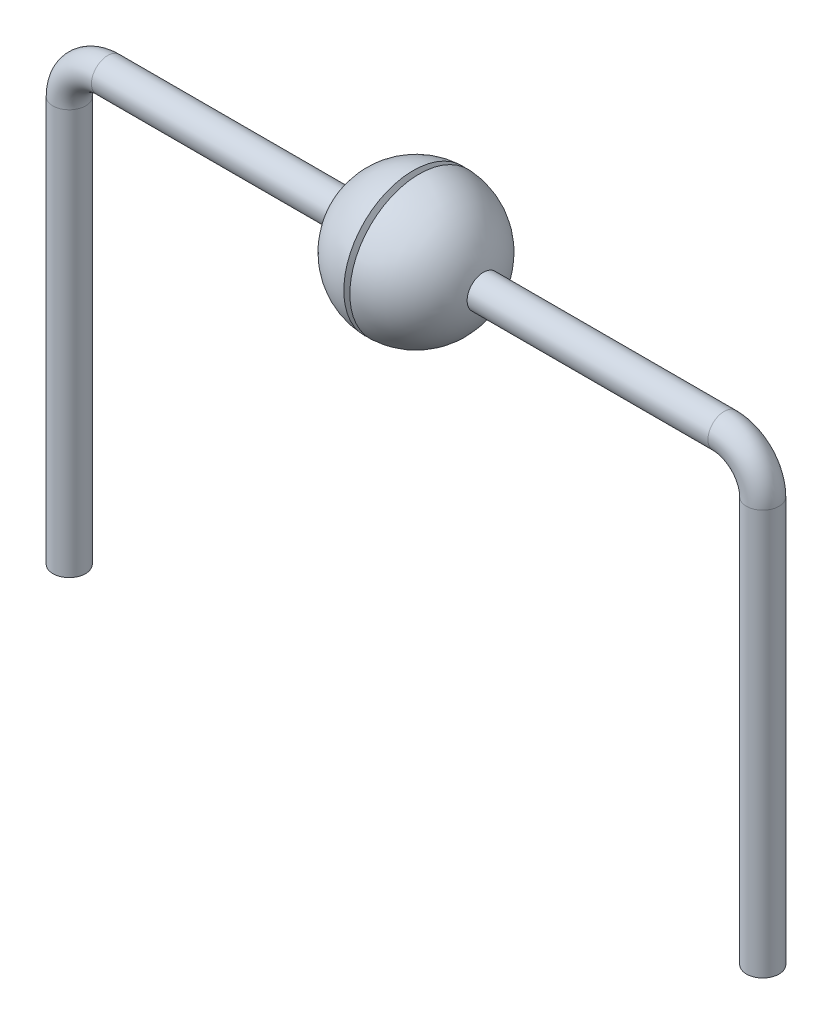
from build123d import *

# Parameters (mm, degrees)
SKETCH_3_R = 0.423054932


with BuildPart() as part:
    # Эскиз1 → Повернуть2 (revolve)
    with BuildSketch(Plane(origin=(0, 0, 0), x_dir=(1, 0, 0), z_dir=(0, 1, 0))):
        with BuildLine():
            Line((-1.749578385, 0.423054932), (-1.749578385, 0))
            Line((-1.749578385, 0), (1.749578385, 0))
            Line((1.749578385, 0), (1.749578385, 0.423054932))
            ThreePointArc((1.749578385, 0.423054932), (1.144753012, 1.389079027), (0.080960724, 1.798178345))
            Line((0.080960724, 1.798178345), (0, 1.645856706))
            Line((0, 1.645856706), (-0.075759465, 1.798404989))
            ThreePointArc((-0.075759465, 1.798404989), (-1.142742977, 1.390733076), (-1.749578385, 0.423054932))
        make_face()
    revolve(axis=Axis((-29.751182373, 0, 0), (1, 0, 0)))

    # По траектории1: sweep along a path in Эскиз2
    with BuildLine(Plane.XY) as sweep_1_path:
        Line((0, 0), (-8, 0))
        ThreePointArc((-8, 0), (-8.707106781, -0.292893219), (-9, -1))
        Line((-9, -1), (-9, -11.514871198))
    # Эскиз3 → По траектории1 (sweep)
    with BuildSketch(Plane.ZY.offset(1.749578385)):
        Circle(SKETCH_3_R)
    sweep_1 = sweep(path=sweep_1_path.line)

    # Зеркальное отражение1: По траектории1 across plane
    add(sweep_1.mirror(Plane(origin=(0, 0, 0), x_dir=(0, 0, 1), z_dir=(1, 0, 0))))


solid = part.part
